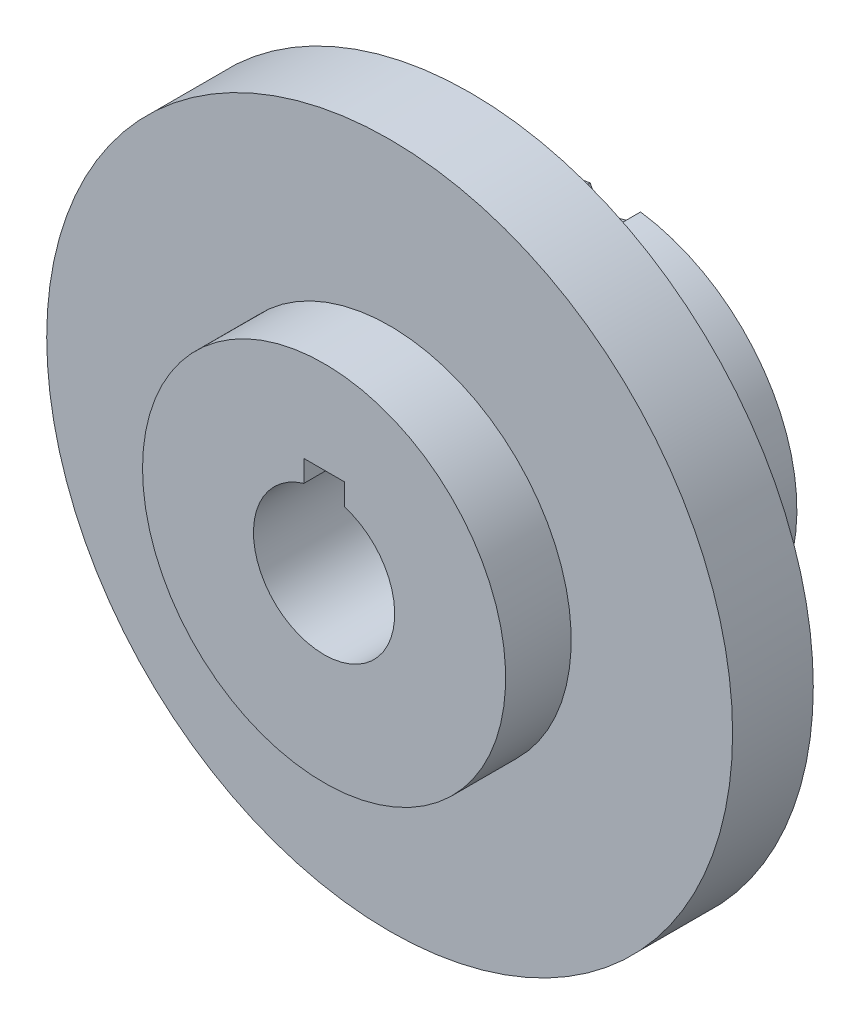
from build123d import *

# Parameters (mm, degrees)
EXTRUDE_START   = -6
EXTRUDE_1_DEPTH = 14.374594
SKETCH_3_R      = 34
EXTRUDE_2_DEPTH = 8
SKETCH_5_R      = 18
EXTRUDE_3_DEPTH = 6.5


with BuildPart() as part:
    # Эскиз1 → Вытянуть1 (new body)
    with BuildSketch(Plane.XY.offset(EXTRUDE_START)):
        with BuildLine():
            ThreePointArc((-2.5, 17.82554347), (-15.588457268, 9), (-16.687373481, -6.747708226))
            ThreePointArc((-16.687373481, -6.747708226), (-14.029608141, -8.099998037), (-14.187373481, -11.077835244))
            ThreePointArc((-14.187373481, -11.077835244), (0, -18), (14.187373481, -11.077835244))
            ThreePointArc((14.187373481, -11.077835244), (14.029608141, -8.099998037), (16.687373481, -6.747708226))
            ThreePointArc((16.687373481, -6.747708226), (15.588457268, 9), (2.5, 17.82554347))
            ThreePointArc((2.5, 17.82554347), (0, 16.199996074), (-2.5, 17.82554347))
        make_face()
        with BuildLine():
            Line((-2, 8.85), (2, 8.85))
            Line((2, 8.85), (2, 6.708203932))
            ThreePointArc((2, 6.708203932), (0, -7), (-2, 6.708203932))
            Line((-2, 6.708203932), (-2, 8.85))
        make_face(mode=Mode.SUBTRACT)
    extrude(amount=EXTRUDE_1_DEPTH)

    # Эскиз3 → Вытянуть2 (add)
    with BuildSketch(Plane.XY.offset(8.374593773)):
        Circle(SKETCH_3_R)
        with BuildLine():
            Line((-2, 8.85), (-2, 6.708203932))
            ThreePointArc((-2, 6.708203932), (0, -7), (2, 6.708203932))
            Line((2, 6.708203932), (2, 8.85))
            Line((2, 8.85), (-2, 8.85))
        make_face(mode=Mode.SUBTRACT)
    extrude(amount=EXTRUDE_2_DEPTH)

    # Эскиз5 → Вытянуть3 (add)
    with BuildSketch(Plane.XY.offset(16.374593773)):
        with Locations(Location((0, 0, 0), (0, 0, 180))):
            Circle(SKETCH_5_R)
        with BuildLine():
            Line((-2, 6.708203932), (-2, 8.85))
            Line((-2, 8.85), (2, 8.85))
            Line((2, 8.85), (2, 6.708203932))
            ThreePointArc((2, 6.708203932), (0, -7), (-2, 6.708203932))
        make_face(mode=Mode.SUBTRACT)
    extrude(amount=EXTRUDE_3_DEPTH)


solid = part.part
